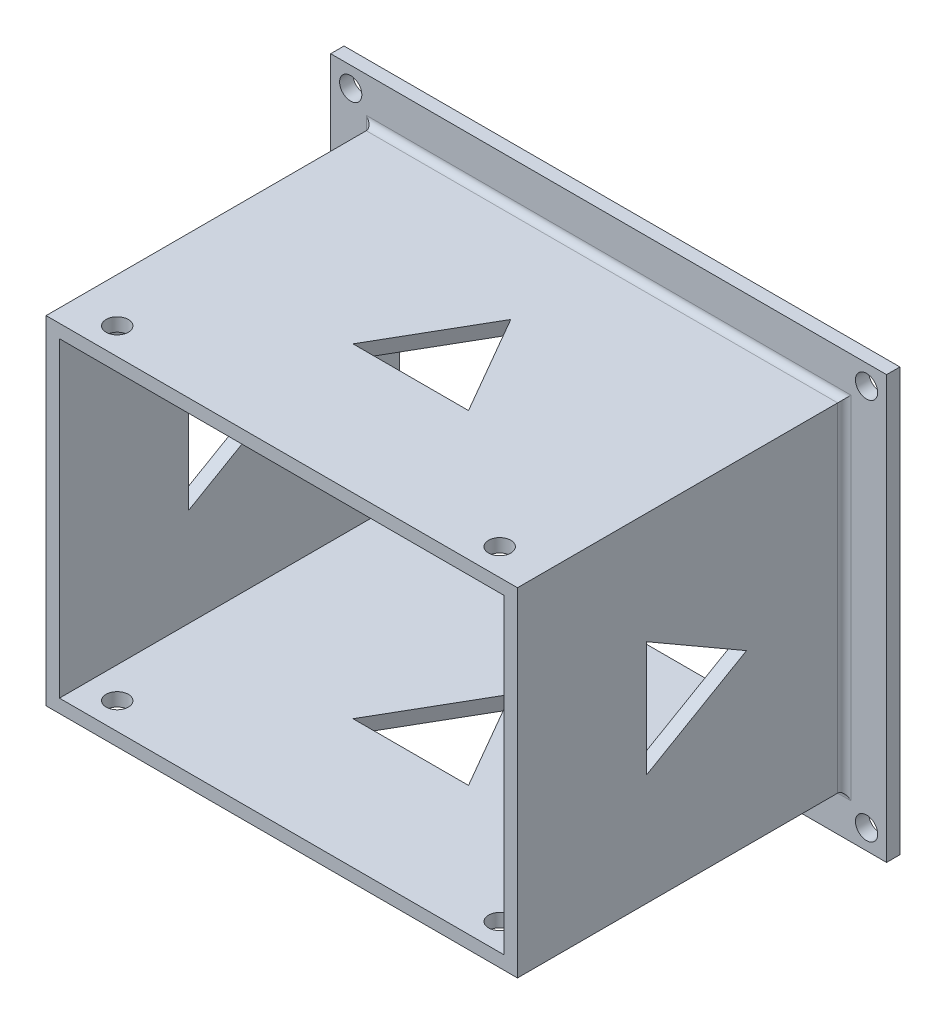
from build123d import *

# Parameters (mm, degrees)
SKETCH_1_W          = 125
SKETCH_1_H          = 95
SKETCH_1_W_2        = 100
SKETCH_1_H_2        = 70
EXTRUDE_1_DEPTH     = 3
SKETCH_2_W          = 106
SKETCH_2_H          = 76
SKETCH_2_W_2        = 100
SKETCH_2_H_2        = 70
EXTRUDE_2_DEPTH     = 73.5
SKETCH_3_R          = 2.5
CUT_EXTRUDE_1_DEPTH = 113.5
FILLET_1_R          = 1.5
SKETCH_4_R          = 2.5
CUT_EXTRUDE_2_DEPTH = 113.5
CUT_EXTRUDE_3_DEPTH = 113.5
CUT_EXTRUDE_4_DEPTH = 113.5


with BuildPart() as part:
    # 草图1 → 凸台-拉伸1 (new body)
    with BuildSketch(Plane.XY):
        Rectangle(SKETCH_1_W, SKETCH_1_H)
        Rectangle(SKETCH_1_W_2, SKETCH_1_H_2, mode=Mode.SUBTRACT)
    extrude(amount=EXTRUDE_1_DEPTH)

    # 草图2 → 凸台-拉伸2 (add)
    with BuildSketch(Plane.XY.offset(3)):
        Rectangle(SKETCH_2_W, SKETCH_2_H)
        Rectangle(SKETCH_2_W_2, SKETCH_2_H_2, mode=Mode.SUBTRACT)
    extrude(amount=EXTRUDE_2_DEPTH)

    # 草图3 → 切除-拉伸1 (cut)
    with BuildSketch(Plane.XZ.offset(38)):
        with Locations(Location((-43, 70.5, 0), (0, 0, 270))):
            Circle(SKETCH_3_R)
        with Locations(Location((43, 70.5, 0), (0, 0, 90))):
            Circle(SKETCH_3_R)
    extrude(amount=-CUT_EXTRUDE_1_DEPTH, mode=Mode.SUBTRACT)

    # 圆角1
    fillet_1_edges = [part.edges().sort_by_distance(p)[0] for p in [
        (53, 0, 3),
        (0, 38, 3),
        (-53, 0, 3),
        (0, -38, 3),
    ]]
    fillet(fillet_1_edges, radius=FILLET_1_R)

    # 草图4 → 切除-拉伸2 (cut)
    with BuildSketch(Plane.XY.offset(3)):
        with Locations((-58, 43)):
            Circle(SKETCH_4_R)
        with Locations((58, 43)):
            Circle(SKETCH_4_R)
        with Locations((58, -43)):
            Circle(SKETCH_4_R)
        with Locations((-58, -43)):
            Circle(SKETCH_4_R)
    extrude(amount=-CUT_EXTRUDE_2_DEPTH, mode=Mode.SUBTRACT)

    # 草图5 → 切除-拉伸3 (cut)
    with BuildSketch(Plane.XZ.offset(38)):
        Polygon((0, 25), (12.990381057, 47.5), (-12.990381057, 47.5), align=None)
    extrude(amount=-CUT_EXTRUDE_3_DEPTH, mode=Mode.SUBTRACT)

    # 草图6 → 切除-拉伸4 (cut)
    with BuildSketch(Plane.ZY.offset(53)):
        Polygon((25, 0), (47.5, -12.990381057), (47.5, 12.990381057), align=None)
    extrude(amount=-CUT_EXTRUDE_4_DEPTH, mode=Mode.SUBTRACT)


solid = part.part
